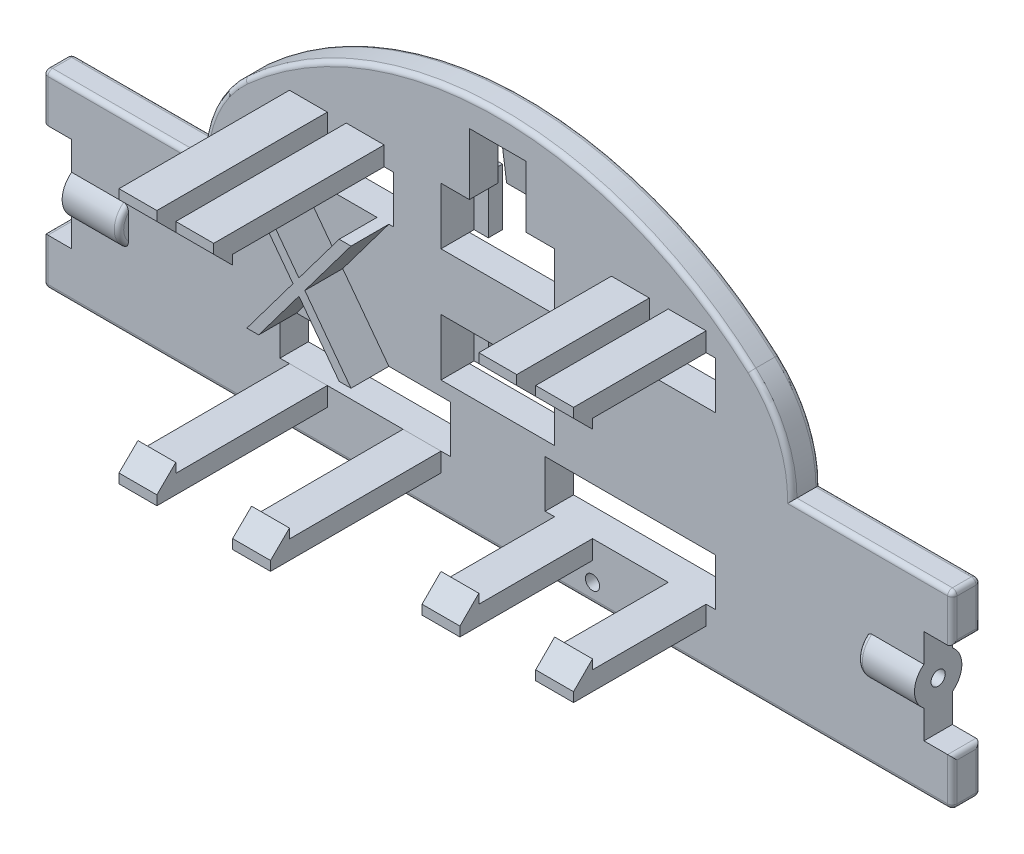
from build123d import *

# Parameters (mm, degrees)
BOSS_EXTRU_1_DEPTH      = 3
ESQUISSE2_R             = 2.5
BOSS_EXTRU_2_DEPTH      = 6
ESQUISSE3_R             = 0.75
ENL_V_MAT_EXTRU_1_DEPTH = 6
ESQUISSE4_W             = 3
ESQUISSE4_H             = 6.5
ESQUISSE4_W_2           = 12
ESQUISSE4_H_2           = 5
ESQUISSE4_W_3           = 6
ESQUISSE4_H_3           = 6
ESQUISSE4_W_4           = 18
ESQUISSE4_R             = 0.75
ESQUISSE4_H_4           = 0.52470933
ENL_V_MAT_EXTRU_2_DEPTH = 63.60990337
BOSS_EXTRU_3_DEPTH      = 6
BOSS_EXTRU_4_DEPTH      = 6
BOSS_EXTRU_5_START      = 1
BOSS_EXTRU_5_DEPTH      = 4
BOSS_EXTRU_6_START      = 1
BOSS_EXTRU_6_DEPTH      = 4
BOSS_EXTRU_7_START      = 1
BOSS_EXTRU_7_DEPTH      = 4
BOSS_EXTRU_8_START      = 1
BOSS_EXTRU_8_DEPTH      = 4
BOSS_EXTRU_9_START      = 1
BOSS_EXTRU_9_DEPTH      = 4
BOSS_EXTRU_10_START     = 1
BOSS_EXTRU_10_DEPTH     = 4
BOSS_EXTRU_11_START     = 1
BOSS_EXTRU_11_DEPTH     = 4
BOSS_EXTRU_12_START     = 1
BOSS_EXTRU_12_DEPTH     = 4
BOSS_EXTRU_13_DEPTH     = 4
BOSS_EXTRU_14_START     = 1
BOSS_EXTRU_14_DEPTH     = 4
CONG_1_R                = 0.5


with BuildPart() as part:
    # Esquisse1 → Boss.-Extru.1 (new body)
    with BuildSketch(Plane.XY):
        with BuildLine():
            Line((-48, 20), (-48, 40))
            ThreePointArc((-48, 40), (-33.669449313, 37.344816468), (-21.241410735, 29.73176585))
            ThreePointArc((-21.241410735, 29.73176585), (-18.039770304, 25.326636658), (-16.907248094, 20))
            Line((-16.907248094, 20), (0, 20))
            Line((0, 20), (0, 15))
            Line((0, 15), (-3, 15))
            Line((-3, 15), (-3, 5))
            Line((-3, 5), (0, 5))
            Line((0, 5), (0, 0))
            Line((0, 0), (-48, 0))
            Line((-48, 0), (-48, 20))
        make_face()
    boss_extru_1 = extrude(amount=BOSS_EXTRU_1_DEPTH)

    # Esquisse2 → Boss.-Extru.2 (add)
    with BuildSketch(Plane(origin=(-3, 0, 0), x_dir=(0, 0, -1), z_dir=(1, 0, 0))):
        with Locations((-1.5, 10)):
            Circle(ESQUISSE2_R)
    boss_extru_2 = extrude(amount=-BOSS_EXTRU_2_DEPTH)

    # Esquisse3 → Enlèv. mat.-Extru.1 (cut)
    with BuildSketch(Plane(origin=(-3, 0, 0), x_dir=(0, 0, -1), z_dir=(1, 0, 0))):
        with Locations(Location((-1.5, 10, 0), (0, 0, 90))):
            Circle(ESQUISSE3_R)
    enl_v_mat_extru_1 = extrude(amount=-ENL_V_MAT_EXTRU_1_DEPTH, mode=Mode.SUBTRACT)

    # Esquisse4 → Enlèv. mat.-Extru.2 (cut, through all)
    with BuildSketch(Plane.XY.offset(3)):
        Polygon((-48, 29.97529067), (-48, 24.5), (-42, 24.5), (-42, 30.5), (-45, 30.5), (-45, 29.97529067), align=None)
        with Locations((-46.5, 33.75)):
            Rectangle(ESQUISSE4_W, ESQUISSE4_H)
        with Locations((-31, 26.5)):
            Rectangle(ESQUISSE4_W_2, ESQUISSE4_H_2)
        with Locations((-45, 15.5)):
            Rectangle(ESQUISSE4_W_3, ESQUISSE4_H_3)
        with Locations((-34, 8.5)):
            Rectangle(ESQUISSE4_W_4, ESQUISSE4_H_2)
        with Locations((-38, 2)):
            Circle(ESQUISSE4_R)
        with Locations((-46.5, 30.237645335)):
            Rectangle(ESQUISSE4_W, ESQUISSE4_H_4)
    enl_v_mat_extru_2 = extrude(amount=-ENL_V_MAT_EXTRU_2_DEPTH, mode=Mode.SUBTRACT)

    # Esquisse5 → Boss.-Extru.3 (add)
    with BuildSketch(Plane(origin=(0, 12.5, 0), x_dir=(1, 0, 0), z_dir=(0, 1, 0))):
        Polygon((-40.5, 0), (-40.5, 2), (-43.5, 2), (-43.5, 0.5), (-42, 0.5), (-42, 0), align=None)
    boss_extru_3 = extrude(amount=BOSS_EXTRU_3_DEPTH)

    # Esquisse6 → Boss.-Extru.4 (add)
    with BuildSketch(Plane(origin=(0, 24.5, 0), x_dir=(1, 0, 0), z_dir=(0, 1, 0))):
        Polygon((-42, 0), (-42, 0.5), (-43.5, 0.5), (-43.5, 2), (-40.5, 2), (-40.5, 0), align=None)
    boss_extru_4 = extrude(amount=BOSS_EXTRU_4_DEPTH)

    # Esquisse7 → Boss.-Extru.5 (add)
    with BuildSketch(Plane.ZY.offset(25).offset(BOSS_EXTRU_5_START)):
        Polygon((3, 6), (15, 6), (15, 7), (17, 5), (17, 4), (3, 4), align=None)
    extrude(amount=BOSS_EXTRU_5_DEPTH)

    # Esquisse8 → Boss.-Extru.6 (add)
    with BuildSketch(Plane(origin=(-43, 0, 0), x_dir=(0, 0, -1), z_dir=(1, 0, 0)).offset(BOSS_EXTRU_6_START)):
        Polygon((-3, 6), (-3, 4), (-17, 4), (-17, 5), (-15, 7), (-15, 6), align=None)
    extrude(amount=BOSS_EXTRU_6_DEPTH)

    # Esquisse9 → Boss.-Extru.7 (add)
    with BuildSketch(Plane.ZY.offset(25).offset(BOSS_EXTRU_7_START)):
        Polygon((3, 29), (15, 29), (15, 28), (17, 30), (17, 31), (3, 31), align=None)
    extrude(amount=BOSS_EXTRU_7_DEPTH)

    # Esquisse10 → Boss.-Extru.8 (add)
    with BuildSketch(Plane(origin=(-37, 0, 0), x_dir=(0, 0, -1), z_dir=(1, 0, 0)).offset(BOSS_EXTRU_8_START)):
        Polygon((-3, 29), (-3, 31), (-17, 31), (-17, 30), (-15, 28), (-15, 29), align=None)
    extrude(amount=BOSS_EXTRU_8_DEPTH)

    # Symétrie1: Boss.-Extru.1, Boss.-Extru.2, Enlèv. mat.-Extru.1, Enlèv. mat.-Extru.2, Boss.-Extru.3, Boss.-Extru.4 across plane
    add(boss_extru_1.mirror(Plane(origin=(-48, 0, 3), x_dir=(0, 0, 1), z_dir=(1, 0, 0))))
    add(boss_extru_2.mirror(Plane(origin=(-48, 0, 3), x_dir=(0, 0, 1), z_dir=(1, 0, 0))))
    add(enl_v_mat_extru_1.mirror(Plane(origin=(-48, 0, 3), x_dir=(0, 0, 1), z_dir=(1, 0, 0))), mode=Mode.SUBTRACT)
    add(enl_v_mat_extru_2.mirror(Plane(origin=(-48, 0, 3), x_dir=(0, 0, 1), z_dir=(1, 0, 0))), mode=Mode.SUBTRACT)
    add(boss_extru_3.mirror(Plane(origin=(-48, 0, 3), x_dir=(0, 0, 1), z_dir=(1, 0, 0))))
    add(boss_extru_4.mirror(Plane(origin=(-48, 0, 3), x_dir=(0, 0, 1), z_dir=(1, 0, 0))))

    # Esquisse13 → Boss.-Extru.9 (add)
    with BuildSketch(Plane.ZY.offset(53).offset(BOSS_EXTRU_9_START)):
        Polygon((3, 6), (3, 4), (21, 4), (21, 5), (19, 6.966166747), (19, 5.966166747), align=None)
    extrude(amount=BOSS_EXTRU_9_DEPTH)

    # Esquisse14 → Boss.-Extru.10 (add)
    with BuildSketch(Plane(origin=(-71, 0, 0), x_dir=(0, 0, -1), z_dir=(1, 0, 0)).offset(BOSS_EXTRU_10_START)):
        Polygon((-3, 6), (-3, 4), (-21, 4), (-21, 5), (-19, 6.966166747), (-19, 5.966166747), align=None)
    extrude(amount=BOSS_EXTRU_10_DEPTH)

    # Esquisse16 → Boss.-Extru.11 (add)
    with BuildSketch(Plane.ZY.offset(59).offset(BOSS_EXTRU_11_START)):
        Polygon((3, 29), (19, 29), (19, 28), (21, 30), (21, 31), (3, 31), align=None)
    extrude(amount=BOSS_EXTRU_11_DEPTH)

    # Esquisse17 → Boss.-Extru.12 (add)
    with BuildSketch(Plane(origin=(-71, 0, 0), x_dir=(0, 0, -1), z_dir=(1, 0, 0)).offset(BOSS_EXTRU_12_START)):
        Polygon((-3, 29), (-3, 31), (-21, 31), (-21, 30), (-19, 28), (-19, 29), align=None)
    extrude(amount=BOSS_EXTRU_12_DEPTH)

    # Esquisse18 → Boss.-Extru.13 (add)
    with BuildSketch(Plane.XY.offset(3)):
        Polygon((-59.5, 24), (-64.375, 17.5), (-59.5, 11), (-60.75, 11), (-65, 16.666666667), (-69.25, 11), (-70.5, 11), (-65.625, 17.5), (-70.5, 24), (-69.25, 24), (-65, 18.333333333), (-60.75, 24), align=None)
    extrude(amount=BOSS_EXTRU_13_DEPTH)

    # Esquisse19 → Boss.-Extru.14 (add)
    with BuildSketch(Plane.ZY.offset(45).offset(BOSS_EXTRU_14_START)):
        Polygon((0.8, 37), (0.06878394, 31.04472309), (-0.73121606, 31.04472309), (0, 37), align=None)
    extrude(amount=BOSS_EXTRU_14_DEPTH)

    # Congé1
    cong_1_edges = [part.edges().sort_by_distance(p)[0] for p in [
        (-48, 0, 0),
        (-48, 40, 0),
        (-18.039770304, 25.326636658, 0),
        (-8.453624047, 20, 0),
        (0, 17.5, 0),
        (0, 2.5, 0),
        (0, 17.5, 3),
        (0, 0, 1.5),
        (0, 20, 1.5),
        (0, 15, 1.5),
        (0, 5, 1.5),
        (-8.453624047, 20, 3),
        (-18.039770304, 25.326636658, 3),
        (-96, 2.5, 3),
        (-96, 5, 1.5),
        (-96, 0, 1.5),
        (-77.960229696, 25.326636658, 3),
        (-87.546375953, 20, 3),
        (-96, 17.5, 3),
        (-96, 20, 1.5),
        (-96, 15, 1.5),
        (-96, 2.5, 0),
        (-96, 17.5, 0),
        (-87.546375953, 20, 0),
        (-77.960229696, 25.326636658, 0),
        (-48, 40, 3),
        (-87, 10, -1),
        (-87, 10, 4),
        (-48, 0, 3),
        (-9, 10, -1),
        (-9, 10, 4),
        (0, 2.5, 3),
    ]]
    fillet(cong_1_edges, radius=CONG_1_R)


solid = part.part
